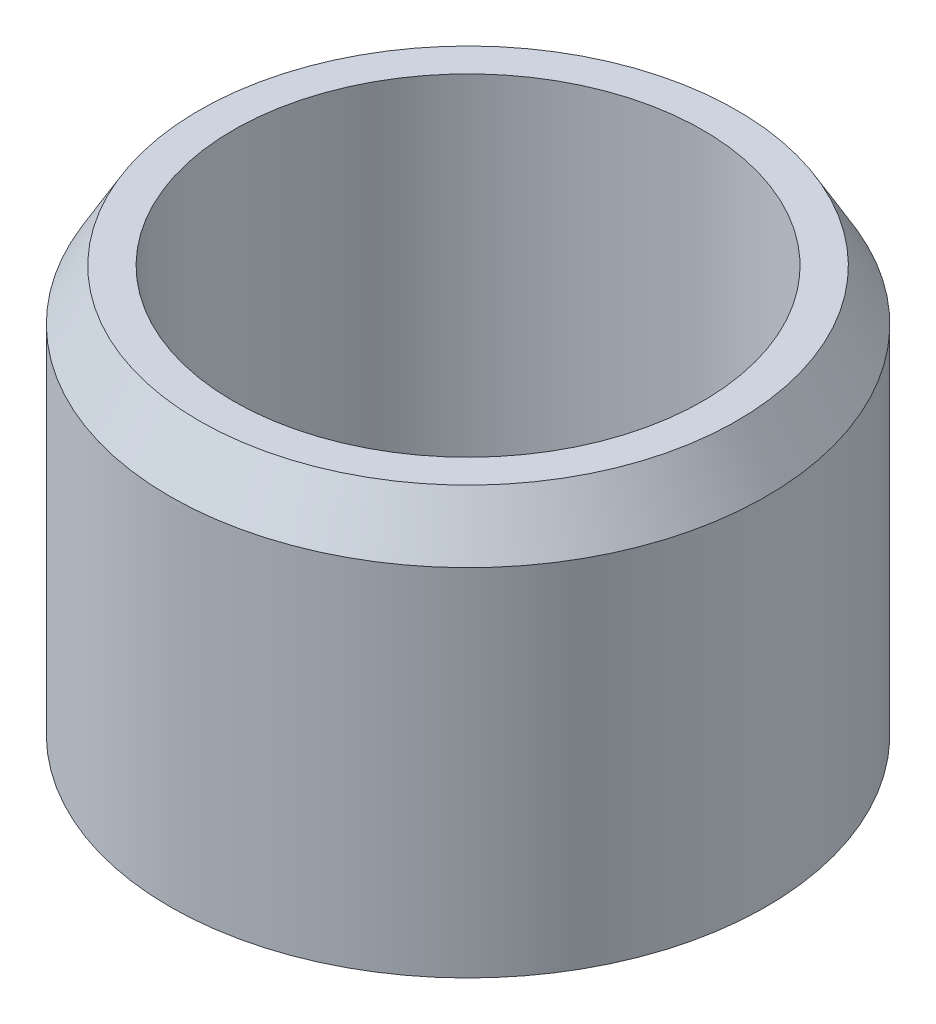
from build123d import *

# Parameters (mm, degrees)
SKETCH1_R           = 23.5
BOSS_EXTRUDE1_DEPTH = 32
SKETCH2_R           = 18.5
CUT_EXTRUDE1_DEPTH  = 32
CHAMFER1_SIZE       = 4
CHAMFER1_SIZE2      = 2.309401077


with BuildPart() as part:
    # Sketch1 → Boss-Extrude1 (new body)
    with BuildSketch(Plane(origin=(0, 0, 0), x_dir=(1, 0, 0), z_dir=(0, 1, 0))):
        with Locations(Location((0, 0, 0), (0, 0, 270))):
            Circle(SKETCH1_R)
    extrude(amount=BOSS_EXTRUDE1_DEPTH)

    # Sketch2 → Cut-Extrude1 (cut)
    with BuildSketch(Plane(origin=(0, 32, 0), x_dir=(1, 0, 0), z_dir=(0, 1, 0))):
        with Locations(Location((0, 0, 0), (0, 0, 270))):
            Circle(SKETCH2_R)
    extrude(amount=-CUT_EXTRUDE1_DEPTH, mode=Mode.SUBTRACT)

    # Chamfer1
    chamfer1_edges = [part.edges().sort_by_distance(p)[0] for p in [
        (0, 32, -23.5),
    ]]
    chamfer1_side = [part.faces().sort_by_distance(p)[0] for p in [
        (0, 16, -23.5),
    ]]
    chamfer(chamfer1_edges, length=CHAMFER1_SIZE, length2=CHAMFER1_SIZE2, reference=chamfer1_side[0])


solid = part.part
